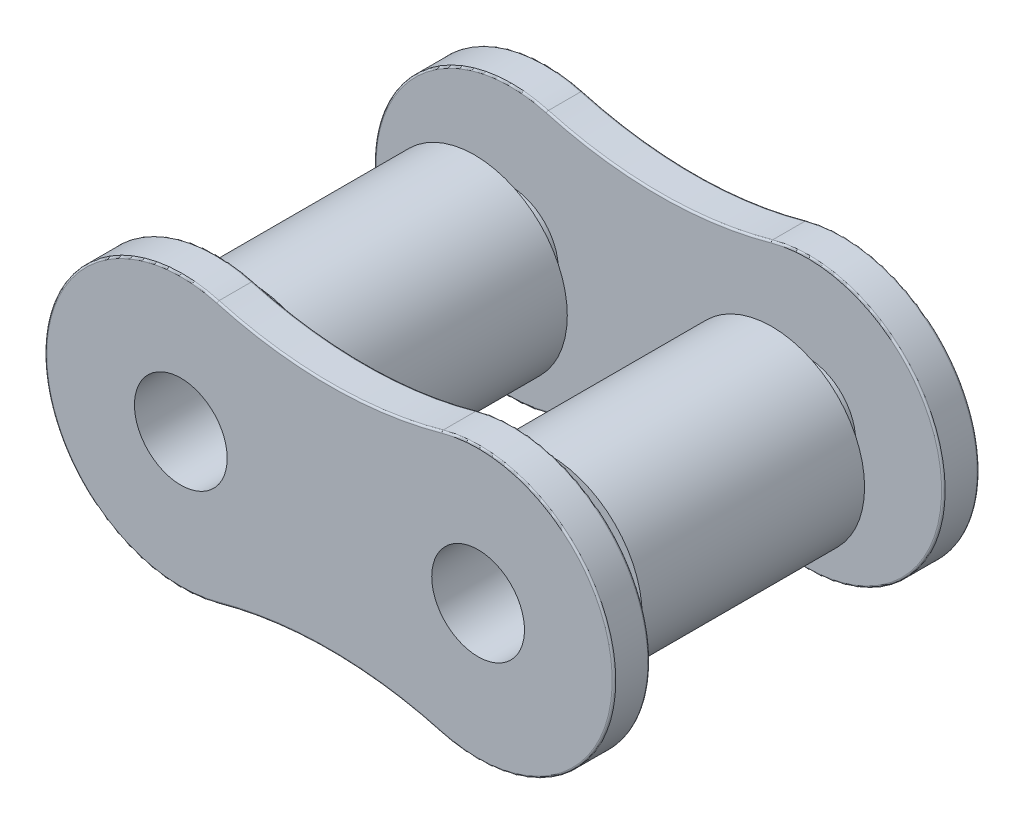
from build123d import *

# Parameters (mm, degrees)
SKETCH1_R                                  = 3.9624
SKETCH1_R_2                                = 1.9812
BOSS_EXTRUDE2_DEPTH                        = 6.274
BOSS_EXTRUDE2_2_DEPTH                      = 6.274
BOSS_EXTRUDE3_START                        = 6.274
SKETCH3_R                                  = 1.9812
BOSS_EXTRUDE3_DEPTH                        = 1.524
BOSS_EXTRUDE4_START                        = -7.798
SKETCH3_2_R                                = 1.9812
BOSS_EXTRUDE4_DEPTH                        = 1.524
FILLET1_R                                  = 0.0762
SKETCH5_W                                  = 1.524
SKETCH5_H                                  = 1.905
MIRROR2_AT_THE_SECOND_PLANE_COPY_1_SKETC_W = 1.524
MIRROR2_AT_THE_SECOND_PLANE_COPY_1_SKETC_H = 1.905


with BuildPart() as part:
    # Sketch1 → Boss-Extrude2 (new, symmetric)
    with BuildSketch(Plane.XY):
        with Locations((-6.35, 0)):
            Circle(SKETCH1_R)
        with Locations((-6.35, 0)):
            Circle(SKETCH1_R_2, mode=Mode.SUBTRACT)
    extrude(amount=BOSS_EXTRUDE2_DEPTH, both=True)



with BuildPart() as body_2:
    # Sketch1 → Boss-Extrude2 2 (new, symmetric)
    with BuildSketch(Plane.XY):
        with Locations((6.35, 0)):
            Circle(SKETCH1_R)
        with Locations((6.35, 0)):
            Circle(SKETCH1_R_2, mode=Mode.SUBTRACT)
    extrude(amount=BOSS_EXTRUDE2_2_DEPTH, both=True)


with BuildPart() as part_1:
    add(part.part)

    add(body_2.part)  # Boss-Extrude3 merges body 2
    # Sketch3 → Boss-Extrude3 (add)
    with BuildSketch(Plane.XY.offset(BOSS_EXTRUDE3_START)):
        with BuildLine():
            ThreePointArc((4.787931893, -5.589740462), (12.1539, 0), (4.787931893, 5.589740462))
            ThreePointArc((4.787931893, 5.589740462), (0, 4.933315), (-4.787931893, 5.589740462))
            ThreePointArc((-4.787931893, 5.589740462), (-12.1539, 0), (-4.787931893, -5.589740462))
            ThreePointArc((-4.787931893, -5.589740462), (0, -4.933315), (4.787931893, -5.589740462))
        make_face()
        with Locations((-6.35, 0)):
            Circle(SKETCH3_R, mode=Mode.SUBTRACT)
        with Locations(Location((6.35, 0, 0), (0, 0, 180))):
            Circle(SKETCH3_R, mode=Mode.SUBTRACT)
    extrude(amount=BOSS_EXTRUDE3_DEPTH)

    # Sketch3<2> → Boss-Extrude4 (add)
    with BuildSketch(Plane.XY.offset(BOSS_EXTRUDE4_START)):
        with BuildLine():
            ThreePointArc((4.787931893, -5.589740462), (12.1539, 0), (4.787931893, 5.589740462))
            ThreePointArc((4.787931893, 5.589740462), (0, 4.933315), (-4.787931893, 5.589740462))
            ThreePointArc((-4.787931893, 5.589740462), (-12.1539, 0), (-4.787931893, -5.589740462))
            ThreePointArc((-4.787931893, -5.589740462), (0, -4.933315), (4.787931893, -5.589740462))
        make_face()
        with Locations((-6.35, 0)):
            Circle(SKETCH3_2_R, mode=Mode.SUBTRACT)
        with Locations(Location((6.35, 0, 0), (0, 0, 180))):
            Circle(SKETCH3_2_R, mode=Mode.SUBTRACT)
    extrude(amount=BOSS_EXTRUDE4_DEPTH)

    # Fillet1
    fillet1_edges = [part_1.edges().sort_by_distance(p)[0] for p in [
        (0, -4.933315, 6.274),
        (0, 4.933315, 6.274),
        (0, -4.933315, 7.798),
        (12.1539, 0, 6.274),
        (0, 4.933315, 7.798),
        (-12.1539, 0, 6.274),
        (12.1539, 0, -6.274),
        (-12.1539, 0, -6.274),
        (0, -4.933315, -6.274),
        (-12.1539, 0, -7.798),
        (0, 4.933315, -6.274),
        (12.1539, 0, -7.798),
        (0, -4.933315, -7.798),
        (0, 4.933315, -7.798),
        (12.1539, 0, 7.798),
        (-12.1539, 0, 7.798),
    ]]
    fillet(fillet1_edges, radius=FILLET1_R)

    # Sketch5 → Cut-Revolve2 (revolve, cut)
    with BuildSketch(Plane(origin=(6.35, 0, 0), x_dir=(0, 0, -1), z_dir=(1, 0, 0)), mode=Mode.PRIVATE) as cut_revolve2_sk:
        with Locations((-5.512, 3.0099)):
            Rectangle(SKETCH5_W, SKETCH5_H)
    cut_revolve2 = revolve(cut_revolve2_sk.sketch.rotate(Axis((6.35, 0, 7.798), (0, 0, -1)), 90), axis=Axis((6.35, 0, 7.798), (0, 0, -1)), mode=Mode.SUBTRACT)

    # Mirror2: Cut-Revolve2 across plane
    add(cut_revolve2.mirror(Plane(origin=(0, 0, 0), x_dir=(0, 0, 1), z_dir=(1, 0, 0))), mode=Mode.SUBTRACT)

    # Mirror2 at the second plane: Cut-Revolve2 across plane
    add(cut_revolve2.mirror(Plane.XY), mode=Mode.SUBTRACT)

    # Mirror2 at the second plane copy 1 sketc → Mirror2 at the second plane copy 1 (revolve, cut)
    with BuildSketch(Plane.ZY.offset(6.35)):
        with Locations((-5.512, 3.0099)):
            Rectangle(MIRROR2_AT_THE_SECOND_PLANE_COPY_1_SKETC_W, MIRROR2_AT_THE_SECOND_PLANE_COPY_1_SKETC_H)
    revolve(axis=Axis((-6.35, 0, -7.798), (0, 0, 1)), mode=Mode.SUBTRACT)


solid = part_1.part
